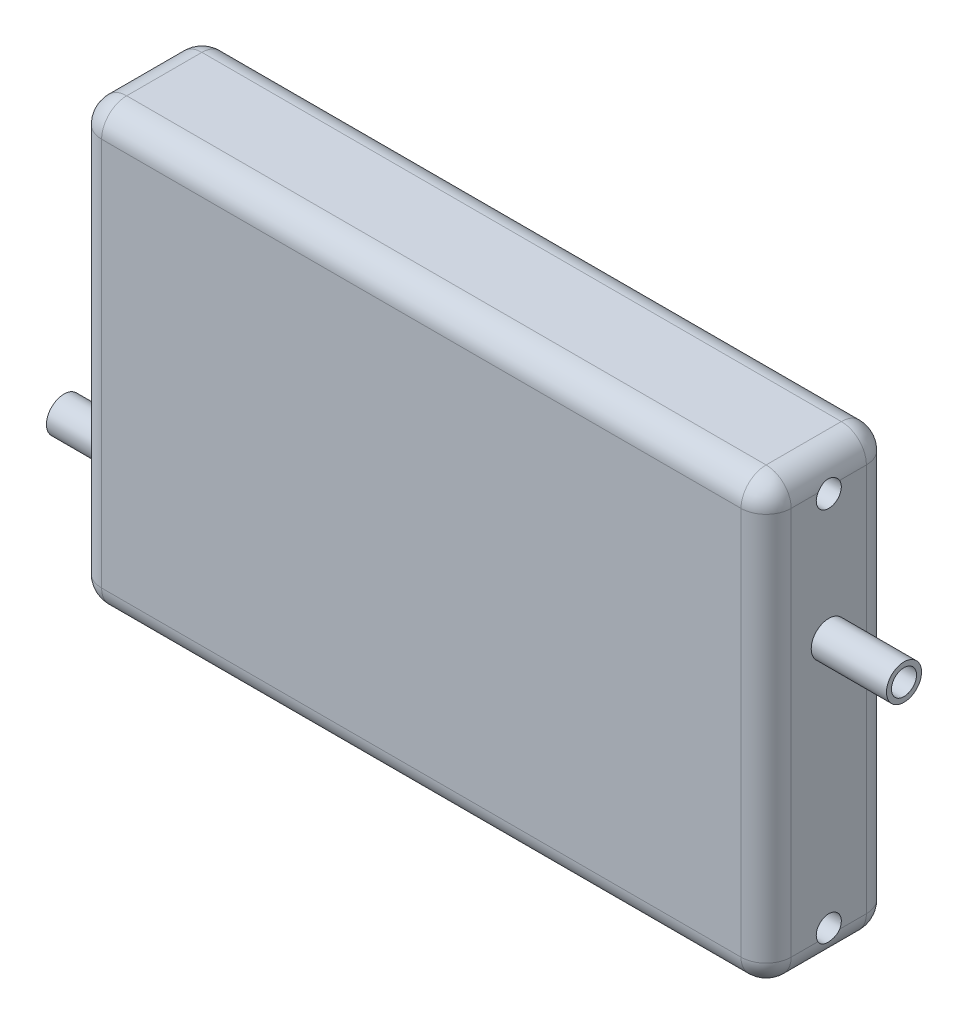
from build123d import *

# Parameters (mm, degrees)
SKETCH1_W           = 275
SKETCH1_H           = 175
BOSS_EXTRUDE1_DEPTH = 25
FILLET1_R           = 10
SKETCH2_R           = 5
CUT_EXTRUDE1_DEPTH  = 180
CUT_EXTRUDE2_DEPTH  = 125
SKETCH5_R           = 5
CUT_EXTRUDE3_DEPTH  = 190
BOSS_EXTRUDE2_START = 30
SKETCH6_R           = 7
SKETCH6_R_2         = 5
BOSS_EXTRUDE2_DEPTH = 30
BOSS_EXTRUDE3_START = 30
SKETCH7_R           = 7
SKETCH7_R_2         = 5
BOSS_EXTRUDE3_DEPTH = 30


with BuildPart() as part:
    # Sketch1 → Boss-Extrude1 (new, symmetric)
    with BuildSketch(Plane.XY):
        Rectangle(SKETCH1_W, SKETCH1_H)
    extrude(amount=BOSS_EXTRUDE1_DEPTH, both=True)

    # Fillet1
    fillet1_edges = [part.edges().sort_by_distance(p)[0] for p in [
        (137.5, 0, 25),
        (0, 87.5, 25),
        (-137.5, 0, 25),
        (0, 87.5, -25),
        (137.5, 0, -25),
        (0, -87.5, -25),
        (-137.5, 0, -25),
        (-137.5, 87.5, 0),
        (137.5, 87.5, 0),
        (137.5, -87.5, 0),
        (-137.5, -87.5, 0),
        (0, -87.5, 25),
    ]]
    fillet(fillet1_edges, radius=FILLET1_R)

    # Sketch2 → Cut-Extrude1 (cut)
    with BuildSketch(Plane(origin=(137.5, 0, 0), x_dir=(0, 0, -1), z_dir=(1, 0, 0))):
        with Locations((0, 75)):
            Circle(SKETCH2_R)
        with Locations((0, 25)):
            Circle(SKETCH2_R)
        with Locations((0, -75)):
            Circle(SKETCH2_R)
    extrude(amount=-CUT_EXTRUDE1_DEPTH, mode=Mode.SUBTRACT)

    # Sketch3 → Cut-Extrude2 (cut, symmetric)
    with BuildSketch(Plane(origin=(0, 0, 0), x_dir=(0, 0, -1), z_dir=(1, 0, 0))):
        with BuildLine():
            Line((-15, 82.5), (15, 82.5))
            ThreePointArc((15, 82.5), (18.535533906, 81.035533906), (20, 77.5))
            Line((20, 77.5), (20, -77.567792301))
            ThreePointArc((20, -77.567792301), (18.535533906, -81.103326207), (15, -82.567792301))
            Line((15, -82.567792301), (-15, -82.567792301))
            ThreePointArc((-15, -82.567792301), (-18.535533906, -81.103326207), (-20, -77.567792301))
            Line((-20, -77.567792301), (-20, 77.5))
            ThreePointArc((-20, 77.5), (-18.535533906, 81.035533906), (-15, 82.5))
        make_face()
    extrude(amount=CUT_EXTRUDE2_DEPTH, both=True, mode=Mode.SUBTRACT)

    # Sketch5 → Cut-Extrude3 (cut)
    with BuildSketch(Plane.ZY.offset(137.5)):
        with Locations((0, -50)):
            Circle(SKETCH5_R)
    extrude(amount=-CUT_EXTRUDE3_DEPTH, mode=Mode.SUBTRACT)

    # Sketch6 → Boss-Extrude2 (add)
    with BuildSketch(Plane(origin=(137.5, 0, 0), x_dir=(0, 0, -1), z_dir=(1, 0, 0)).offset(BOSS_EXTRUDE2_START)):
        with Locations(Location((0, 25, 0), (0, 0, 180))):
            Circle(SKETCH6_R)
        with Locations((0, 25)):
            Circle(SKETCH6_R_2, mode=Mode.SUBTRACT)
    extrude(amount=-BOSS_EXTRUDE2_DEPTH)

    # Sketch7 → Boss-Extrude3 (add)
    with BuildSketch(Plane.ZY.offset(137.5).offset(BOSS_EXTRUDE3_START)):
        with Locations(Location((0, -50, 0), (0, 0, 180))):
            Circle(SKETCH7_R)
        with Locations((0, -50)):
            Circle(SKETCH7_R_2, mode=Mode.SUBTRACT)
    extrude(amount=-BOSS_EXTRUDE3_DEPTH)


solid = part.part
